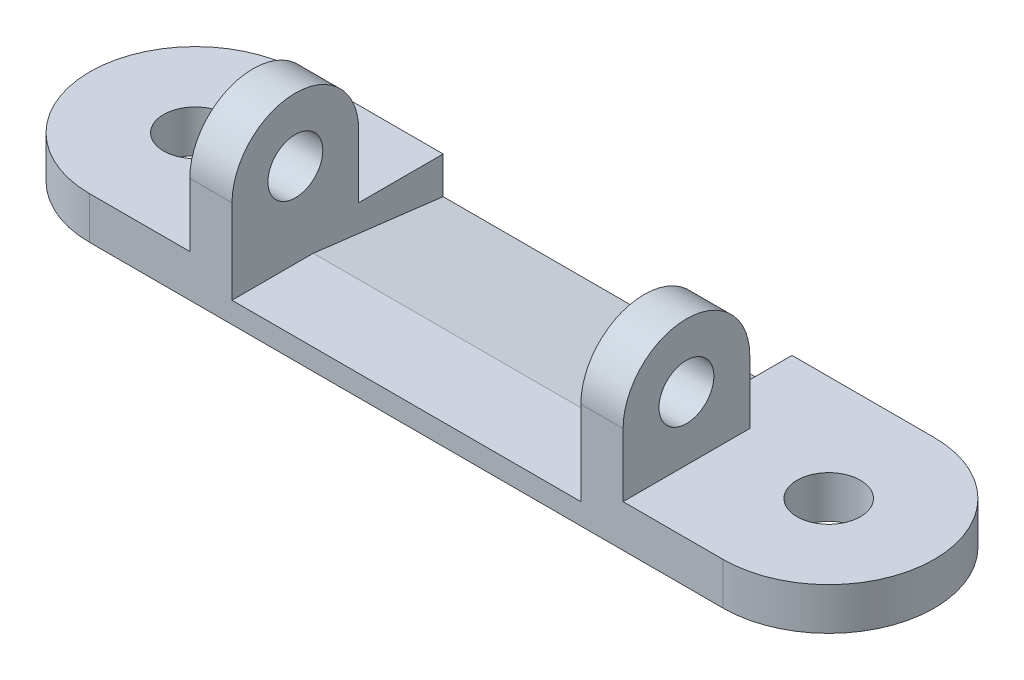
from build123d import *

# Parameters (mm, degrees)
BOSS_EXTRUDE1_DEPTH = 4
SKETCH2_R           = 3
CUT_EXTRUDE1_DEPTH  = 42.424630354
BOSS_EXTRUDE2_DEPTH = 4
SKETCH3_R           = 2.6
CUT_EXTRUDE2_DEPTH  = 60.58873158
SKETCH4_OUTSIDE_W   = 38.8
SKETCH4_OUTSIDE_H   = 34.8
CUT_EXTRUDE3_DEPTH  = 16.522711642


with BuildPart() as part:
    # Sketch1 → Boss-Extrude1 (new body)
    with BuildSketch(Plane(origin=(0, 0, 0), x_dir=(1, 0, 0), z_dir=(0, 1, 0))):
        with BuildLine():
            Line((-30, 10), (30, 10))
            ThreePointArc((30, 10), (40, 0), (30, -10))
            Line((30, -10), (-30, -10))
            ThreePointArc((-30, -10), (-40, 0), (-30, 10))
        make_face()
    extrude(amount=BOSS_EXTRUDE1_DEPTH)

    # Sketch2 → Cut-Extrude1 (cut, through all)
    with BuildSketch(Plane(origin=(0, 4, 0), x_dir=(1, 0, 0), z_dir=(0, 1, 0))):
        with Locations(Location((-30, 0, 0), (0, 0, 270))):
            Circle(SKETCH2_R)
        with Locations(Location((30, 0, 0), (0, 0, 270))):
            Circle(SKETCH2_R)
    extrude(amount=-CUT_EXTRUDE1_DEPTH, mode=Mode.SUBTRACT)

    # 3DSketch1 → Boss-Extrude2 (add)
    with BuildSketch(Plane(origin=(-16.522711642, 4, 10), x_dir=(0, 0.447213595499958, -0.894427190999916), z_dir=(-1, 0, 0))):
        with BuildLine():
            Line((0, 0), (10.733126292, 5.366563146))
            Line((10.733126292, 5.366563146), (13.416407865, 0))
            ThreePointArc((13.416407865, 0), (10.733126292, -8.049844719), (2.683281573, -5.366563146))
            Line((2.683281573, -5.366563146), (0, 0))
        make_face()
    boss_extrude2 = extrude(amount=BOSS_EXTRUDE2_DEPTH)

    # Sketch3 → Cut-Extrude2 (cut, through all)
    with BuildSketch(Plane(origin=(-16.522711642, 0, 0), x_dir=(0, 0, -1), z_dir=(1, 0, 0))):
        with Locations((-4, 10)):
            Circle(SKETCH3_R)
    cut_extrude2 = extrude(amount=-CUT_EXTRUDE2_DEPTH, mode=Mode.SUBTRACT)

    # Sketch4 outside → Cut-Extrude3 (cut)
    with BuildSketch(Plane(origin=(0, 0, 0), x_dir=(0, 0, -1), z_dir=(1, 0, 0))):
        with Locations((0, 8)):
            Rectangle(SKETCH4_OUTSIDE_W, SKETCH4_OUTSIDE_H)
        Polygon((-10, 2), (-2.3, 2), (10, 0.5), (10, 0), (-10, 0), align=None, mode=Mode.SUBTRACT)
    cut_extrude3 = extrude(amount=-CUT_EXTRUDE3_DEPTH, mode=Mode.SUBTRACT)

    # Mirror1: Boss-Extrude2, Cut-Extrude2, Cut-Extrude3 across plane
    add(boss_extrude2.mirror(Plane(origin=(0, 0, 0), x_dir=(0, 0, 1), z_dir=(1, 0, 0))))
    add(cut_extrude2.mirror(Plane(origin=(0, 0, 0), x_dir=(0, 0, 1), z_dir=(1, 0, 0))), mode=Mode.SUBTRACT)
    add(cut_extrude3.mirror(Plane(origin=(0, 0, 0), x_dir=(0, 0, 1), z_dir=(1, 0, 0))), mode=Mode.SUBTRACT)


solid = part.part
